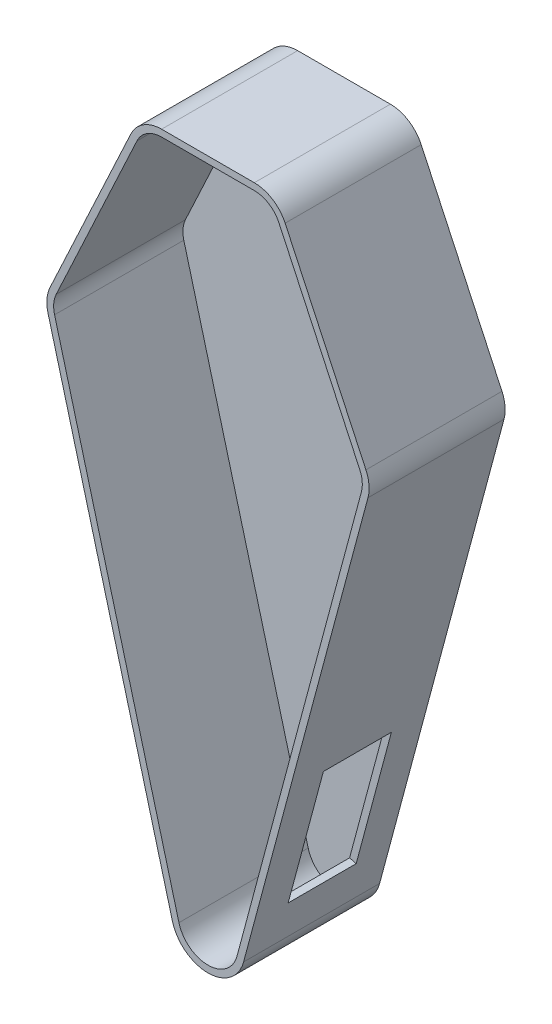
from build123d import *

# Parameters (mm, degrees)
EXTRUDE_1_DEPTH     = 20
FILLET_1_R          = 5
SHELL_1_T           = -1
SKETCH_2_R          = 5
CUT_EXTRUDE_1_DEPTH = 20
CUT_EXTRUDE_2_REACH = 116.219
SKETCH_3_W          = 10
SKETCH_3_H          = 20


with BuildPart() as part:
    # 草图1 → 凸台-拉伸1 (new body)
    with BuildSketch(Plane.XY):
        with BuildLine():
            Line((0, 0), (-20, 0))
            Line((-20, 0), (-33.989229745, -30))
            Line((-33.989229745, -30), (-15.232786274, -100))
            ThreePointArc((-15.232786274, -100), (-10, -104.015258131), (-4.767213726, -100))
            Line((-4.767213726, -100), (13.989229745, -30))
            Line((13.989229745, -30), (0, 0))
        make_face()
    extrude(amount=EXTRUDE_1_DEPTH)

    # 圆角1
    fillet_1_edges = [part.edges().sort_by_distance(p)[0] for p in [
        (13.989229745, -30, 10),
        (-33.989229745, -30, 10),
        (-20, 0, 10),
        (0, 0, 10),
    ]]
    fillet(fillet_1_edges, radius=FILLET_1_R)

    # 抽壳1
    shell_1_openings = [part.faces().sort_by_distance(p)[0] for p in [
        (-10, -44.685846185, 20),
    ]]
    offset(amount=SHELL_1_T, openings=shell_1_openings, kind=Kind.INTERSECTION)

    # 草图2 → 切除-拉伸1 (cut)
    with BuildSketch(Plane(origin=(0, 0, 0), x_dir=(-1, 0, 0), z_dir=(0, 0, -1))):
        with Locations((10, -12)):
            Circle(SKETCH_2_R)
    extrude(amount=-CUT_EXTRUDE_1_DEPTH, mode=Mode.SUBTRACT)

    # 草图3 → 切除-拉伸2 (cut, up to next)
    with BuildSketch(Plane(origin=(20.552129041, -5.506926379, 0), x_dir=(0, 0, -1), z_dir=(0.9659258262890672, -0.2588190451025249, 0)), mode=Mode.PRIVATE) as cut_extrude_2_sk1:
        with Locations((-10, -81.826428333)):
            Rectangle(SKETCH_3_W, SKETCH_3_H)
    cut_extrude_2_tool1 = extrude(cut_extrude_2_sk1.sketch, amount=-CUT_EXTRUDE_2_REACH, mode=Mode.PRIVATE) & part.part
    add(cut_extrude_2_tool1.solids().sort_by_distance((-0.626109, -84.545187, 10))[0], mode=Mode.SUBTRACT)


solid = part.part
